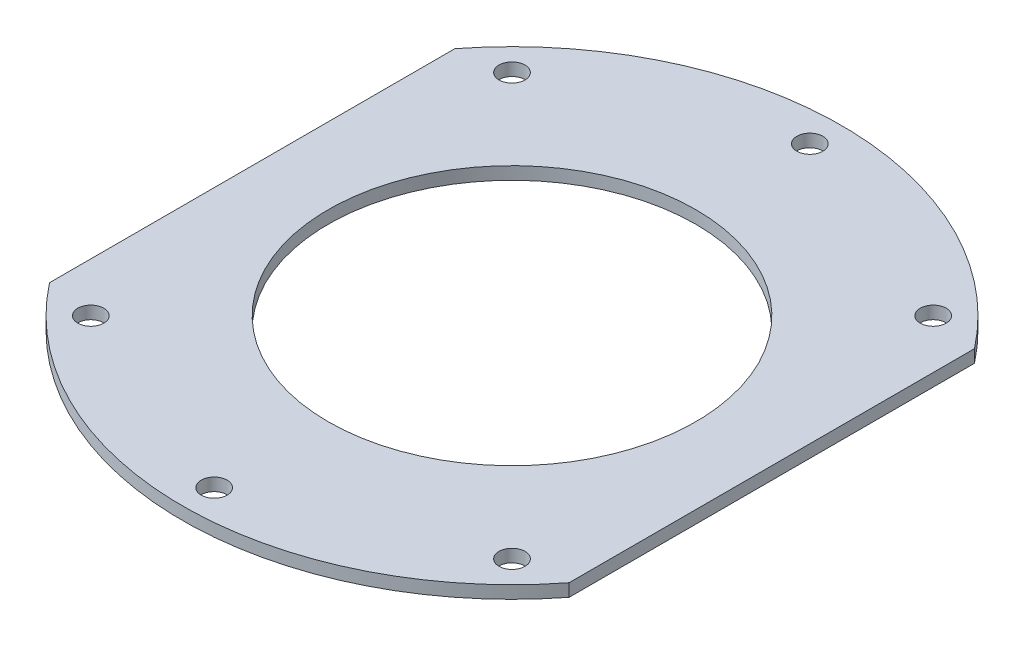
from build123d import *

# Parameters (mm, degrees)
SKETCH_1_R          = 52
SKETCH_1_R_2        = 29
SKETCH_1_R_3        = 2.05
EXTRUDE_1_DEPTH     = 2
SKETCH_2_W          = 182
SKETCH_2_H          = 210.035227354
SKETCH_2_W_2        = 82
SKETCH_2_H_2        = 110.035227354
CUT_EXTRUDE_1_DEPTH = 10


with BuildPart() as part:
    # 草图1 → 凸台-拉伸1 (new body)
    with BuildSketch(Plane(origin=(0, 0, 0), x_dir=(1, 0, 0), z_dir=(0, 1, 0))):
        with Locations(Location((0, 0, 0), (0, 0, 270))):
            Circle(SKETCH_1_R)
        with Locations(Location((0, 0, 0), (0, 0, 270))):
            Circle(SKETCH_1_R_2, mode=Mode.SUBTRACT)
        with Locations(Location((47, 0, 0), (0, 0, 270))):
            Circle(SKETCH_1_R_3, mode=Mode.SUBTRACT)
        with Locations(Location((33.234018716, -33.234018716, 0), (0, 0, 270))):
            Circle(SKETCH_1_R_3, mode=Mode.SUBTRACT)
        with Locations(Location((0, -47, 0), (0, 0, 270))):
            Circle(SKETCH_1_R_3, mode=Mode.SUBTRACT)
        with Locations(Location((-33.234018716, -33.234018716, 0), (0, 0, 270))):
            Circle(SKETCH_1_R_3, mode=Mode.SUBTRACT)
        with Locations(Location((-47, 0, 0), (0, 0, 270))):
            Circle(SKETCH_1_R_3, mode=Mode.SUBTRACT)
        with Locations(Location((-33.234018716, 33.234018716, 0), (0, 0, 270))):
            Circle(SKETCH_1_R_3, mode=Mode.SUBTRACT)
        with Locations(Location((0, 47, 0), (0, 0, 270))):
            Circle(SKETCH_1_R_3, mode=Mode.SUBTRACT)
        with Locations(Location((33.234018716, 33.234018716, 0), (0, 0, 270))):
            Circle(SKETCH_1_R_3, mode=Mode.SUBTRACT)
    extrude(amount=EXTRUDE_1_DEPTH)

    # 草图2 → 切除-拉伸-薄壁1 (cut)
    with BuildSketch(Plane(origin=(0, 2, 0), x_dir=(1, 0, 0), z_dir=(0, 1, 0))):
        Rectangle(SKETCH_2_W, SKETCH_2_H)
        Rectangle(SKETCH_2_W_2, SKETCH_2_H_2, mode=Mode.SUBTRACT)
    extrude(amount=-CUT_EXTRUDE_1_DEPTH, mode=Mode.SUBTRACT)


solid = part.part
